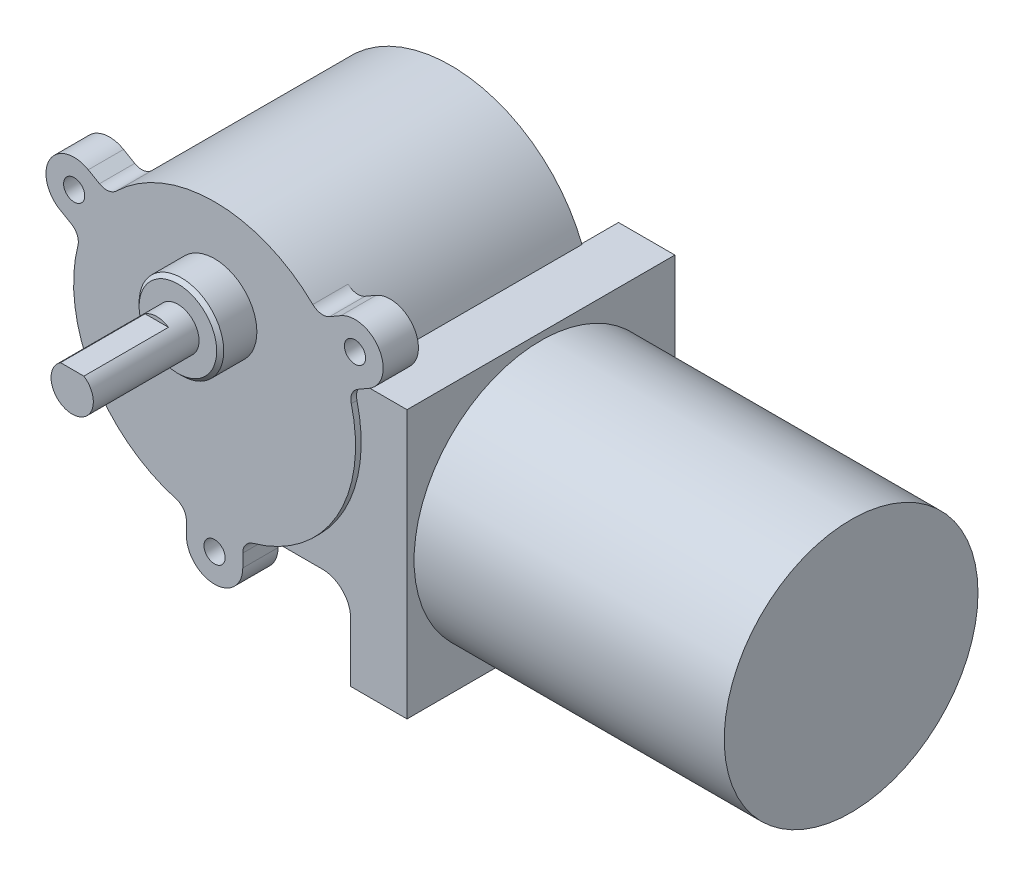
from build123d import *

# Parameters (mm, degrees)
SKETCH_1_R                       = 6
EXTRUDE_1_DEPTH                  = 5.2
CHAMFER_1_SIZE                   = 0.5
SKETCH_2_R                       = 3
EXTRUDE_2_DEPTH                  = 15
SKETCH_3_OUTSIDE_W               = 19.276
SKETCH_3_OUTSIDE_H               = 19.276
CUT_EXTRUDE_1_DEPTH              = 12
SKETCH_4_R                       = 20
EXTRUDE_3_DEPTH                  = 33.5
SKETCH_5_R                       = 1.5
EXTRUDE_4_DEPTH                  = 5
FILLET_2_R                       = 2
PATTERN_CIRCULAR_1_COUNT         = 3
FILLET_2_OF_PATTERN_CIRCULAR_1_R = 2
SKETCH_7_W                       = 38
SKETCH_7_H                       = 38
EXTRUDE_5_DEPTH                  = 8
EXTRUDE_6_REACH                  = 70.746
EXTRUDE_6_END_RADIUS             = 20
SKETCH_8_W                       = 32.7
SKETCH_8_H                       = 10.700657923
SKETCH_10_R                      = 18
EXTRUDE_7_DEPTH                  = 44
FILLET_1_R                       = 4


with BuildPart() as part:
    # ｽｹｯﾁ1 → ﾎﾞｽ - 押し出し1 (new body)
    with BuildSketch(Plane.XY):
        Circle(SKETCH_1_R)
    extrude(amount=EXTRUDE_1_DEPTH)

    # 面取り1
    chamfer_1_edges = [part.edges().sort_by_distance(p)[0] for p in [
        (-6, 0, 5.2),
    ]]
    chamfer(chamfer_1_edges, length=CHAMFER_1_SIZE)

    # ｽｹｯﾁ2 → ﾎﾞｽ - 押し出し2 (add)
    with BuildSketch(Plane.XY.offset(5.2)):
        Circle(SKETCH_2_R)
    extrude(amount=EXTRUDE_2_DEPTH)

    # ｽｹｯﾁ3 outside → ｶｯﾄ - 押し出し1 (cut)
    with BuildSketch(Plane.XY.offset(20.2)):
        Rectangle(SKETCH_3_OUTSIDE_W, SKETCH_3_OUTSIDE_H)
        with BuildLine():
            Line((-1.658312395, 2.5), (1.658312395, 2.5))
            ThreePointArc((1.658312395, 2.5), (0, -3), (-1.658312395, 2.5))
        make_face(mode=Mode.SUBTRACT)
    extrude(amount=-CUT_EXTRUDE_1_DEPTH, mode=Mode.SUBTRACT)

    # ｽｹｯﾁ4 → ﾎﾞｽ - 押し出し3 (add)
    with BuildSketch(Plane(origin=(0, 0, 0), x_dir=(-1, 0, 0), z_dir=(0, 0, -1))):
        with Locations((0, -7)):
            Circle(SKETCH_4_R)
    extrude(amount=EXTRUDE_3_DEPTH)

    # ｽｹｯﾁ5 → ﾎﾞｽ - 押し出し4 (add)
    with BuildSketch(Plane.XY):
        with BuildLine():
            Line((-4, -26.595917942), (-4, -30))
            ThreePointArc((-4, -30), (0, -34), (4, -30))
            Line((4, -30), (4, -26.595917942))
            Line((4, -26.595917942), (-4, -26.595917942))
        make_face()
        with Locations((0, -30)):
            Circle(SKETCH_5_R, mode=Mode.SUBTRACT)
    extrude_4 = extrude(amount=-EXTRUDE_4_DEPTH)

    # ﾌｨﾚｯﾄ2
    fillet_2_edges = [part.edges().sort_by_distance(p)[0] for p in [
        (-4, -26.595917942, -2.5),
        (4, -26.595917942, -2.5),
    ]]
    fillet(fillet_2_edges, radius=FILLET_2_R)

    # 円形ﾊﾟﾀｰﾝ1: ﾎﾞｽ - 押し出し4 ×3 about axis
    pattern_circular_1_axis = Axis((0, -7, 0), (0, 0, 1))
    for i in range(1, PATTERN_CIRCULAR_1_COUNT):
        add(extrude_4.rotate(pattern_circular_1_axis, i * 360 / PATTERN_CIRCULAR_1_COUNT))

    # ﾌｨﾚｯﾄ2 of 円形ﾊﾟﾀｰﾝ1
    fillet_2_of_pattern_circular_1_edges = [part.edges().sort_by_distance(p)[0] for p in [
        (18.970562748, -0.666142644, -2.5),
        (14.970562748, 6.262060586, -2.5),
        (-14.970562748, 6.262060586, -2.5),
        (-18.970562748, -0.666142644, -2.5),
    ]]
    fillet(fillet_2_of_pattern_circular_1_edges, radius=FILLET_2_OF_PATTERN_CIRCULAR_1_R)

    # ｽｹｯﾁ7 → ﾎﾞｽ - 押し出し5 (add)
    with BuildSketch(Plane(origin=(26.5, 0, 0), x_dir=(0, 0, -1), z_dir=(1, 0, 0))):
        with Locations((19.8, -18.7)):
            Rectangle(SKETCH_7_W, SKETCH_7_H)
    extrude(amount=-EXTRUDE_5_DEPTH)

    # ﾎﾞｽ - 押し出し6: up to this cylinder (the profile starts outside it)
    extrude_6_end = Plane(origin=(0, -7, -17.15), z_dir=(0, 0, 1)) * Cylinder(EXTRUDE_6_END_RADIUS, 182.492, mode=Mode.PRIVATE)
    # ｽｹｯﾁ8 → ﾎﾞｽ - 押し出し6 (add, up to the surface)
    with BuildSketch(Plane.ZY.offset(-18.5), mode=Mode.PRIVATE) as extrude_6_sk1:
        with Locations((-17.15, -19.949671039)):
            Rectangle(SKETCH_8_W, SKETCH_8_H)
    extrude_6_tool1 = extrude(extrude_6_sk1.sketch, amount=EXTRUDE_6_REACH, mode=Mode.PRIVATE) - extrude_6_end
    add(extrude_6_tool1.solids().sort_by_distance((18.5, -19.949671, -17.15))[0])

    # ｽｹｯﾁ10 → ﾎﾞｽ - 押し出し7 (add)
    with BuildSketch(Plane(origin=(26.5, 0, 0), x_dir=(0, 0, -1), z_dir=(1, 0, 0))):
        with Locations((19.8, -18.7)):
            Circle(SKETCH_10_R)
    extrude(amount=EXTRUDE_7_DEPTH)

    # ﾌｨﾚｯﾄ1
    fillet_1_edges = [part.edges().sort_by_distance(p)[0] for p in [
        (18.5, -25.3, -17.15),
    ]]
    fillet(fillet_1_edges, radius=FILLET_1_R)


solid = part.part
